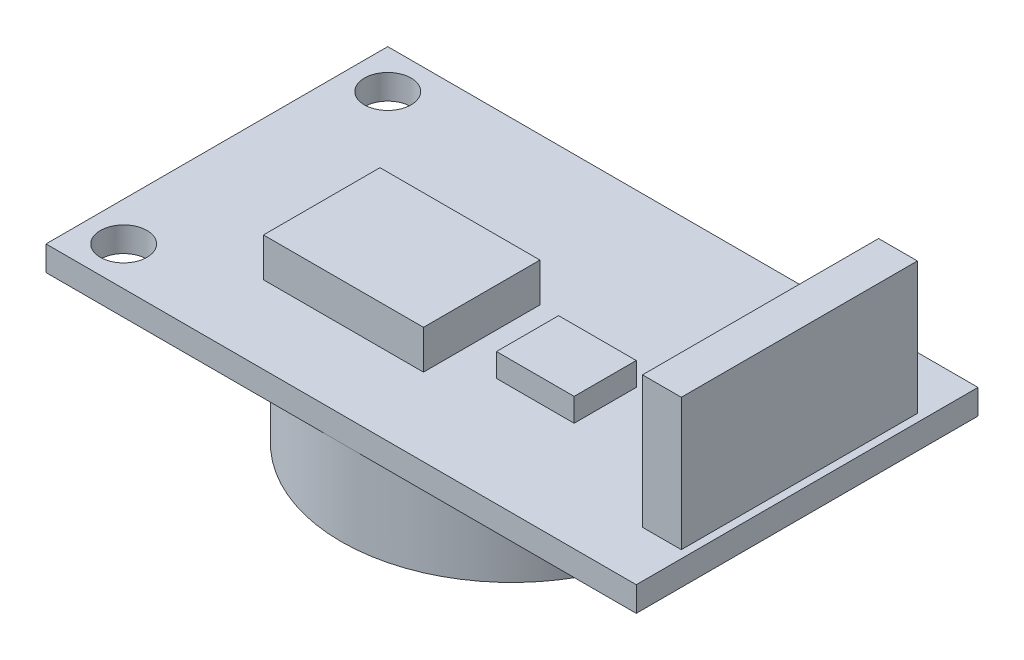
from build123d import *

# Parameters (mm, degrees)
SKETCH1_W               = 38
SKETCH1_H               = 22
PCB_DEPTH               = 1.6
MOUNT_HOLE_1_DEPTH      = 44.938138331
MOUNT_HOLE_1_DEPTH_BACK = 44.938138331
SKETCH2_R               = 1.5
MOUNT_HOLE_2_DEPTH      = 44.938138331
MOUNT_HOLE_2_DEPTH_BACK = 44.938138331
SKETCH3_R               = 1.5
DS3231_IC_START         = 1.6
SKETCH4_W               = 10.3
SKETCH4_H               = 7.5
DS3231_IC_DEPTH         = 2.5
AT24C32_EEPROM_START    = 1.6
SKETCH5_W               = 5
SKETCH5_H               = 4
AT24C32_EEPROM_DEPTH    = 1.5
HEADER_6PIN_START       = 1.6
SKETCH6_W               = 2.5
SKETCH6_H               = 15.2
HEADER_6PIN_DEPTH       = 8.5
SKETCH7_R               = 11
CR2032_HOLDER_DEPTH     = 5.5


with BuildPart() as part:
    # Sketch1 → PCB (new body)
    with BuildSketch(Plane(origin=(0, 0, 0), x_dir=(1, 0, 0), z_dir=(0, 1, 0))):
        with Locations((19, 11)):
            Rectangle(SKETCH1_W, SKETCH1_H)
    extrude(amount=PCB_DEPTH)

    # Sketch2 → Mount_hole_1 (cut, two sides: drawn at the far end of the back side and taken through both)
    with BuildSketch(Plane(origin=(0, 0, 0), x_dir=(1, 0, 0), z_dir=(0, 1, 0)).offset(-MOUNT_HOLE_1_DEPTH_BACK)):
        with Locations(Location((2.5, 19.5, 0), (0, 0, 270))):
            Circle(SKETCH2_R)
    extrude(amount=MOUNT_HOLE_1_DEPTH + MOUNT_HOLE_1_DEPTH_BACK, mode=Mode.SUBTRACT)

    # Sketch3 → Mount_hole_2 (cut, two sides: drawn at the far end of the back side and taken through both)
    with BuildSketch(Plane(origin=(0, 0, 0), x_dir=(1, 0, 0), z_dir=(0, 1, 0)).offset(-MOUNT_HOLE_2_DEPTH_BACK)):
        with Locations(Location((2.5, 2.5, 0), (0, 0, 270))):
            Circle(SKETCH3_R)
    extrude(amount=MOUNT_HOLE_2_DEPTH + MOUNT_HOLE_2_DEPTH_BACK, mode=Mode.SUBTRACT)

    # Sketch4 → DS3231_IC (add)
    with BuildSketch(Plane(origin=(0, 0, 0), x_dir=(1, 0, 0), z_dir=(0, 1, 0)).offset(DS3231_IC_START)):
        with Locations((14.15, 8.75)):
            Rectangle(SKETCH4_W, SKETCH4_H)
    extrude(amount=DS3231_IC_DEPTH)

    # Sketch5 → AT24C32_EEPROM (add)
    with BuildSketch(Plane(origin=(0, 0, 0), x_dir=(1, 0, 0), z_dir=(0, 1, 0)).offset(AT24C32_EEPROM_START)):
        with Locations((24.5, 9)):
            Rectangle(SKETCH5_W, SKETCH5_H)
    extrude(amount=AT24C32_EEPROM_DEPTH)

    # Sketch6 → Header_6pin (add)
    with BuildSketch(Plane(origin=(0, 0, 0), x_dir=(1, 0, 0), z_dir=(0, 1, 0)).offset(HEADER_6PIN_START)):
        with Locations((36.25, 11)):
            Rectangle(SKETCH6_W, SKETCH6_H)
    extrude(amount=HEADER_6PIN_DEPTH)

    # Sketch7 → CR2032_holder (add)
    with BuildSketch(Plane(origin=(0, 0, 0), x_dir=(1, 0, 0), z_dir=(0, 1, 0))):
        with Locations(Location((19, 11, 0), (0, 0, 270))):
            Circle(SKETCH7_R)
    extrude(amount=-CR2032_HOLDER_DEPTH)


solid = part.part
